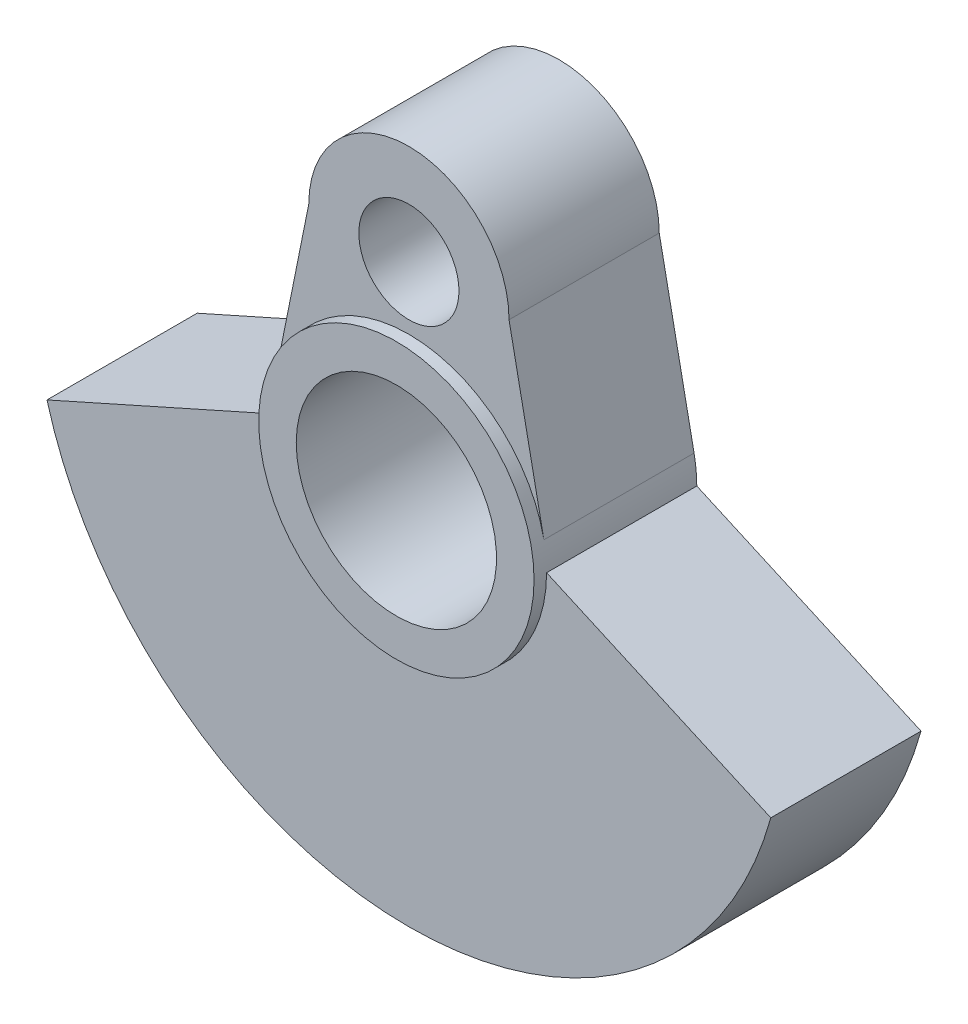
from build123d import *

# Parameters (mm, degrees)
BOSS_EXTRUDE1_DEPTH   = 3
SKETCH1_R             = 2
BOSS_EXTRUDE1_2_DEPTH = 3
BOSS_EXTRUDE2_START   = 3.5
SKETCH1_3_R           = 5.5
SKETCH1_3_R_2         = 4
BOSS_EXTRUDE2_DEPTH   = 6.5


with BuildPart() as part:
    # Sketch1 → Boss-Extrude1 (new, symmetric)
    with BuildSketch(Plane.XY):
        with BuildLine():
            Line((-5.5, 0), (-14.456832295, -4))
            ThreePointArc((-14.456832295, -4), (0, -15), (14.456832295, -4))
            Line((14.456832295, -4), (5.5, 0))
            ThreePointArc((5.5, 0), (0, -5.5), (-5.5, 0))
        make_face()
    extrude(amount=BOSS_EXTRUDE1_DEPTH, both=True)



with BuildPart() as body_2:
    # Sketch1 → Boss-Extrude1 2 (new, symmetric)
    with BuildSketch(Plane.XY):
        with BuildLine():
            Line((-4, 8), (-5.391852394, 1.085323803))
            ThreePointArc((-5.391852394, 1.085323803), (0, 5.5), (5.391852394, 1.085323803))
            Line((5.391852394, 1.085323803), (4, 8))
            ThreePointArc((4, 8), (0, 12), (-4, 8))
        make_face()
        with Locations((0, 8)):
            Circle(SKETCH1_R, mode=Mode.SUBTRACT)
    extrude(amount=BOSS_EXTRUDE1_2_DEPTH, both=True)


with BuildPart() as part_1:
    add(part.part)

    add(body_2.part)  # Boss-Extrude2 merges body 2
    # Sketch1<3> → Boss-Extrude2 (add)
    with BuildSketch(Plane.XY.offset(BOSS_EXTRUDE2_START)):
        Circle(SKETCH1_3_R)
        with Locations(Location((0, 0, 0), (0, 0, 180))):
            Circle(SKETCH1_3_R_2, mode=Mode.SUBTRACT)
    extrude(amount=-BOSS_EXTRUDE2_DEPTH)


solid = part_1.part
